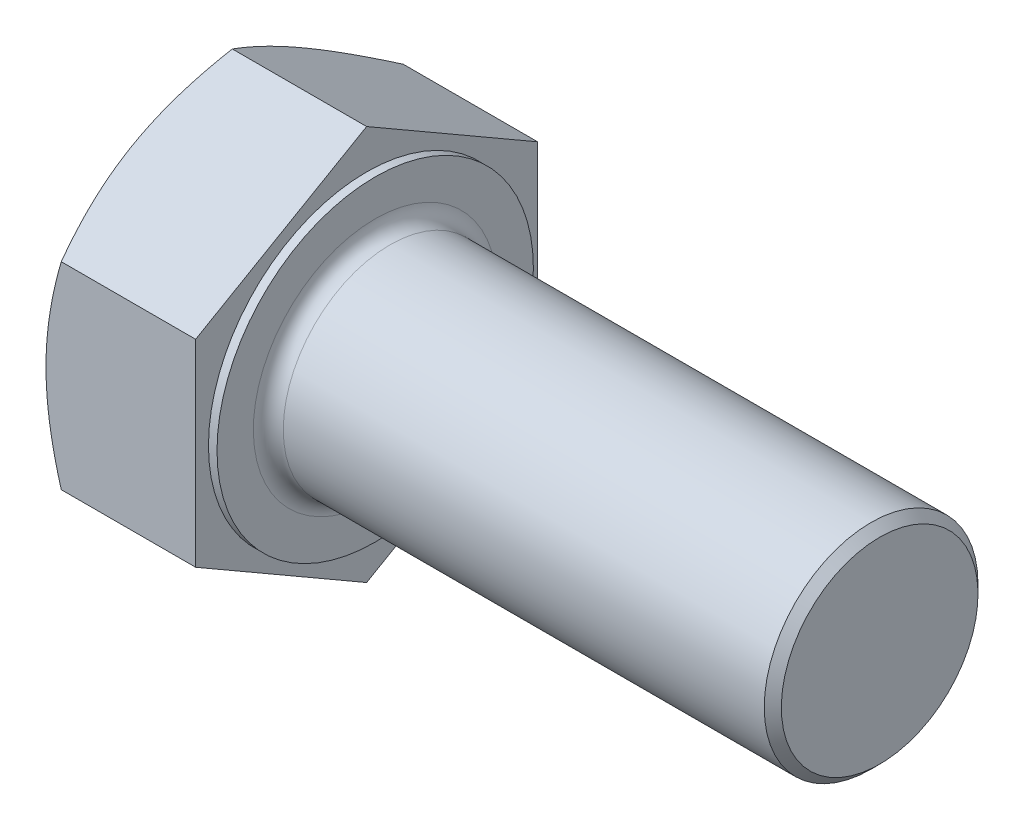
from build123d import *

# Parameters (mm, degrees)
ESTRUSIONE_ESTRUSIONE1_DEPTH = 3.5
SMUSSO1_SIZE                 = 0.2
RACCORDO1_R                  = 0.35


with BuildPart() as part:
    # Schizzo1 → Rivoluzione1 (revolve)
    with BuildSketch(Plane.XY):
        Polygon((0.2, 2.5), (12, 2.5), (12, 0), (0, 0), (0, 3.7), (0.2, 3.7), align=None)
    revolve(axis=Axis((12, 0, 0), (-1, 0, 0)))

    # Schizzo2 → Estrusione-Estrusione1 (add)
    with BuildSketch(Plane.ZY):
        Polygon((0, -4.618802154), (4, -2.309401077), (4, 2.309401077), (0, 4.618802154), (-4, 2.309401077), (-4, -2.309401077), align=None)
    extrude(amount=ESTRUSIONE_ESTRUSIONE1_DEPTH)

    # Schizzo3 → Taglia-Rivoluzione3 (revolve, cut)
    with BuildSketch(Plane.XY):
        Polygon((-3.5, 4), (-3.14273441, 4.618802154), (-3.5, 4.618802154), align=None)
    revolve(axis=Axis((0.2, 0, 0), (1, 0, 0)), mode=Mode.SUBTRACT)

    # Smusso1
    smusso1_edges = [part.edges().sort_by_distance(p)[0] for p in [
        (12, -2.5, 0),
    ]]
    chamfer(smusso1_edges, length=SMUSSO1_SIZE)

    # Raccordo1
    raccordo1_edges = [part.edges().sort_by_distance(p)[0] for p in [
        (0.2, -2.5, 0),
    ]]
    fillet(raccordo1_edges, radius=RACCORDO1_R)


solid = part.part
